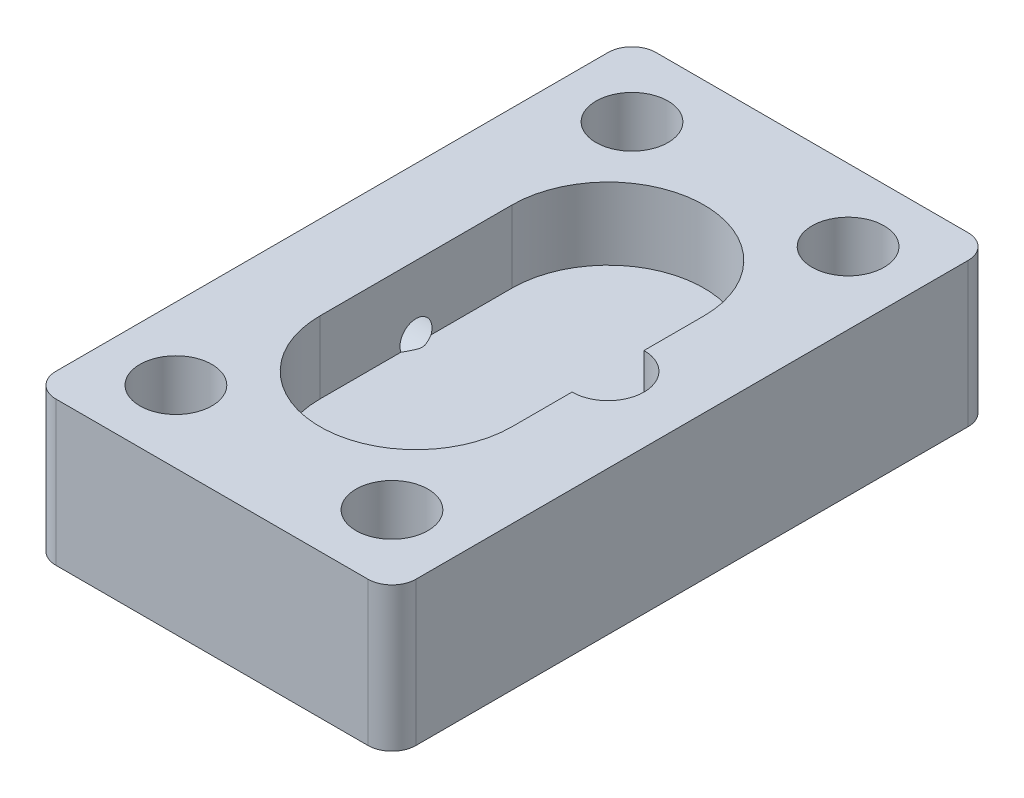
from build123d import *

# Parameters (mm, degrees)
SKETCH1_W                 = 15
SKETCH1_H                 = 25
BOSS_EXTRUDE1_DEPTH       = 6
CUT_EXTRUDE1_DEPTH        = 3
SKETCH3_R                 = 1.5
CUT_EXTRUDE2_DEPTH        = 16.76388277
SKETCH4_R                 = 2.5
CUT_EXTRUDE3_DEPTH        = 3
F_3_0MM_DOWEL_HOLE1_D     = 3
F_3_0MM_DOWEL_HOLE1_DEPTH = 3
F_3_0MM_DOWEL_HOLE1_TIP   = 0.901290929
SKETCH7_R                 = 2.5
CUT_EXTRUDE4_DEPTH        = 1.5
FILLET1_R                 = 1


with BuildPart() as part:
    # Sketch1 → Boss-Extrude1 (new body)
    with BuildSketch(Plane(origin=(0, 0, 0), x_dir=(1, 0, 0), z_dir=(0, 1, 0))):
        Rectangle(SKETCH1_W, SKETCH1_H)
    extrude(amount=BOSS_EXTRUDE1_DEPTH)

    # Sketch2 → Cut-Extrude1 (cut)
    with BuildSketch(Plane(origin=(0, 6, 0), x_dir=(1, 0, 0), z_dir=(0, 1, 0))):
        with BuildLine():
            Line((4, 4), (4, 1.5))
            ThreePointArc((4, 1.5), (5.5, 0), (4, -1.5))
            Line((4, -1.5), (4, -4))
            ThreePointArc((4, -4), (0, -8), (-4, -4))
            Line((-4, -4), (-4, 4))
            ThreePointArc((-4, 4), (0, 8), (4, 4))
        make_face()
    extrude(amount=-CUT_EXTRUDE1_DEPTH, mode=Mode.SUBTRACT)

    # Sketch3 → Cut-Extrude2 (cut, through all)
    with BuildSketch(Plane(origin=(0, 6, 0), x_dir=(1, 0, 0), z_dir=(0, 1, 0))):
        with Locations(Location((-4.5, 9.5, 0), (0, 0, 270))):
            Circle(SKETCH3_R)
        with Locations(Location((4.5, 9.5, 0), (0, 0, 270))):
            Circle(SKETCH3_R)
        with Locations(Location((-4.5, -9.5, 0), (0, 0, 270))):
            Circle(SKETCH3_R)
        with Locations(Location((4.5, -9.5, 0), (0, 0, 270))):
            Circle(SKETCH3_R)
    extrude(amount=-CUT_EXTRUDE2_DEPTH, mode=Mode.SUBTRACT)

    # Sketch4 → Cut-Extrude3 (cut)
    with BuildSketch(Plane.XZ):
        with Locations(Location((4, 0, 0), (0, 0, 270))):
            Circle(SKETCH4_R)
    extrude(amount=-CUT_EXTRUDE3_DEPTH, mode=Mode.SUBTRACT)

    # Ø3.0mm Dowel Hole1
    with Locations(Plane.ZY.offset(7.5)):
        with Locations((0, 3.230523086)):
            Hole(F_3_0MM_DOWEL_HOLE1_D / 2, depth=F_3_0MM_DOWEL_HOLE1_DEPTH)
            with Locations((0, 0, -(F_3_0MM_DOWEL_HOLE1_DEPTH + F_3_0MM_DOWEL_HOLE1_TIP / 2))):  # 118° drill point
                Cone(0, F_3_0MM_DOWEL_HOLE1_D / 2, F_3_0MM_DOWEL_HOLE1_TIP, mode=Mode.SUBTRACT)

    # Sketch7 → Cut-Extrude4 (cut)
    with BuildSketch(Plane.ZY.offset(7.5)):
        with Locations((0, 3.230523086)):
            Circle(SKETCH7_R)
    extrude(amount=-CUT_EXTRUDE4_DEPTH, mode=Mode.SUBTRACT)

    # Fillet1
    fillet1_edges = [part.edges().sort_by_distance(p)[0] for p in [
        (7.5, 3, 12.5),
        (-7.5, 3, 12.5),
        (-7.5, 3, -12.5),
        (7.5, 3, -12.5),
    ]]
    fillet(fillet1_edges, radius=FILLET1_R)


solid = part.part
